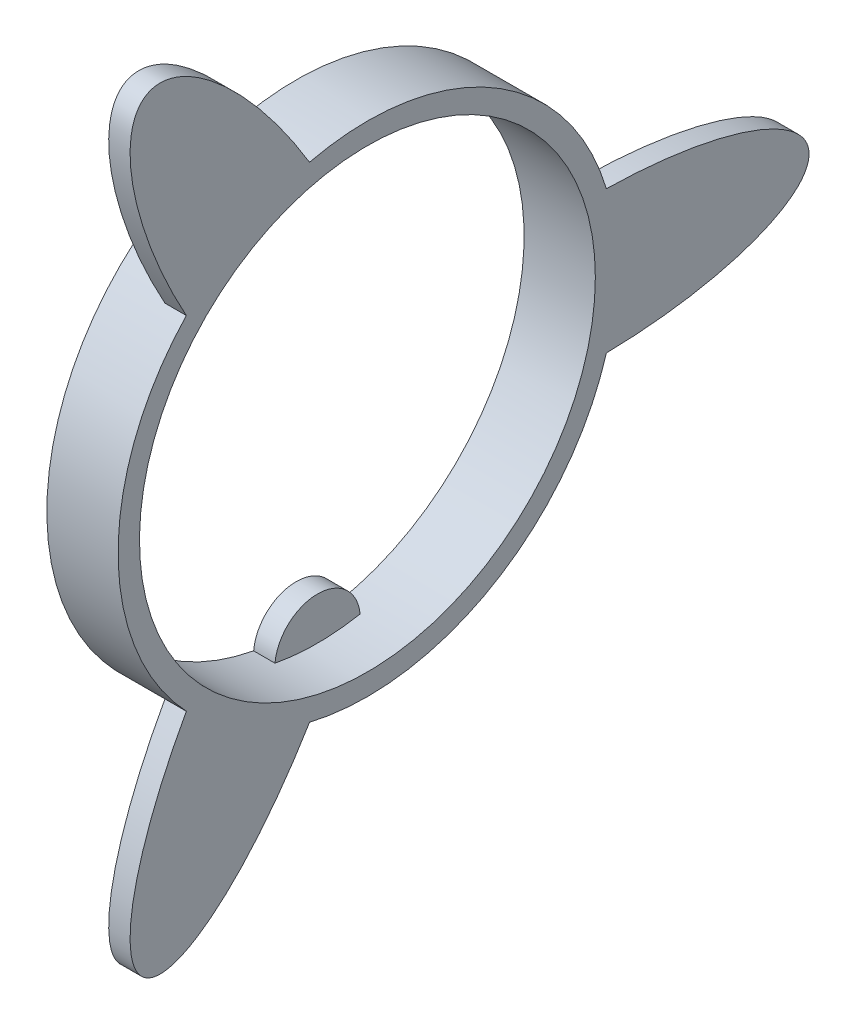
from build123d import *

# Parameters (mm, degrees)
SKETCH1_R           = 17.5
SKETCH1_R_2         = 16
BOSS_EXTRUDE1_DEPTH = 5
BOSS_EXTRUDE2_START = -1.5
BOSS_EXTRUDE2_DEPTH = 1.5
BOSS_EXTRUDE3_DEPTH = 1.5


with BuildPart() as part:
    # Sketch1 → Boss-Extrude1 (new body)
    with BuildSketch(Plane(origin=(0, 0, 0), x_dir=(0, 0, -1), z_dir=(1, 0, 0))):
        Circle(SKETCH1_R)
        Circle(SKETCH1_R_2, mode=Mode.SUBTRACT)
    extrude(amount=BOSS_EXTRUDE1_DEPTH)

    # Sketch2 → Boss-Extrude2 (add)
    with BuildSketch(Plane(origin=(5, 0, 0), x_dir=(0, 0, -1), z_dir=(1, 0, 0)).offset(BOSS_EXTRUDE2_START)):
        with BuildLine():
            ThreePointArc((-12.710624375, 12.028716805), (-8.75, 15.155444566), (-4.061862141, 17.02208201))
            add(Edge.make_bspline(
                [(-4.061862141, 17.02208201), (-11.387413396, 29.2211905), (-15.5, 26.846787517), (-19.612586604, 24.472384534), (-12.710624375, 12.028716805)],
                knots=[1.622318219, 1.622318219, 1.622318219, 3.141592654, 3.141592654, 4.660867088, 4.660867088, 4.660867088], degree=2, weights=[1, 0.725085892, 1, 0.725085892, 1]))
        make_face()
        with BuildLine():
            ThreePointArc((16.772486516, 4.993365204), (17.5, 0), (16.772486516, -4.993365204))
            add(Edge.make_bspline(
                [(16.772486516, -4.993365204), (31, -4.748805966), (31, 0), (31, 4.748805966), (16.772486516, 4.993365204)],
                knots=[1.622318219, 1.622318219, 1.622318219, 3.141592654, 3.141592654, 4.660867088, 4.660867088, 4.660867088], degree=2, weights=[1, 0.725085892, 1, 0.725085892, 1]))
        make_face()
        with BuildLine():
            add(Edge.make_bspline(
                [(-15.5, -26.846787517), (-11.387413396, -29.2211905), (-4.061862141, -17.02208201)],
                knots=[0, 0, 0, 1.519274435, 1.519274435, 1.519274435], degree=2, weights=[1, 0.725085892, 1]))
            ThreePointArc((-4.061862141, -17.02208201), (-8.75, -15.155444566), (-12.710624375, -12.028716805))
            add(Edge.make_bspline(
                [(-12.710624375, -12.028716805), (-19.612586604, -24.472384534), (-15.5, -26.846787517)],
                knots=[4.763910873, 4.763910873, 4.763910873, 6.283185307, 6.283185307, 6.283185307], degree=2, weights=[1, 0.725085892, 1]))
        make_face()
    extrude(amount=BOSS_EXTRUDE2_DEPTH)

    # Sketch3 → Boss-Extrude3 (add)
    with BuildSketch(Plane.ZY):
        with BuildLine():
            Line((3, -16), (-3, -16))
            ThreePointArc((-3, -16), (0, -13), (3, -16))
        make_face()
        with BuildLine():
            Line((3, 16), (-3, 16))
            ThreePointArc((-3, 16), (0, 13), (3, 16))
        make_face()
    extrude(amount=-BOSS_EXTRUDE3_DEPTH)


solid = part.part
